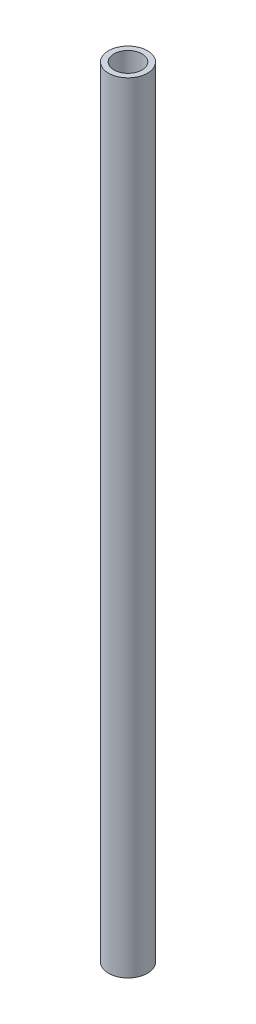
from build123d import *

# Parameters (mm, degrees)
SKETCH1_R           = 3.175
SKETCH1_R_2         = 2.286
BOSS_EXTRUDE1_DEPTH = 127


with BuildPart() as part:
    # Sketch1 → Boss-Extrude1 (new body)
    with BuildSketch(Plane(origin=(0, 0, 0), x_dir=(1, 0, 0), z_dir=(0, 1, 0))):
        with Locations(Location((0, 0, 0), (0, 0, 270))):
            Circle(SKETCH1_R)
        with Locations(Location((0, 0, 0), (0, 0, 270))):
            Circle(SKETCH1_R_2, mode=Mode.SUBTRACT)
    extrude(amount=BOSS_EXTRUDE1_DEPTH)


solid = part.part
